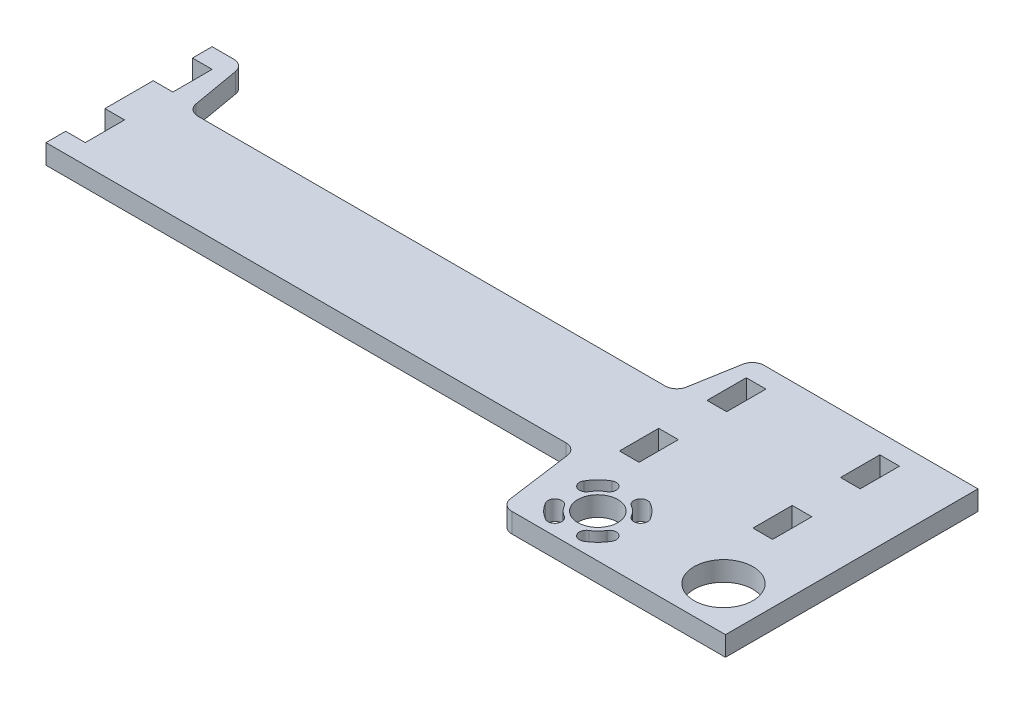
from build123d import *

# Parameters (mm, degrees)
SKETCH_1_R      = 5.1
SKETCH_1_R_2    = 7.5
SKETCH_1_W      = 5
SKETCH_1_H      = 10
EXTRUDE_1_DEPTH = 5


with BuildPart() as part:
    # 草图1 → 凸台-拉伸1 (new body)
    with BuildSketch(Plane(origin=(0, 0, 0), x_dir=(1, 0, 0), z_dir=(0, 1, 0))):
        with BuildLine():
            Line((41.226602941, -22.421259901), (43.51896829, -39.231939129))
            ThreePointArc((43.51896829, -39.231939129), (44.518645935, -41.086690093), (46.491458794, -41.826599515))
            Line((46.491458794, -41.826599515), (46.872785616, -41.826599515))
            Line((46.872785616, -41.826599515), (100.872785616, -41.826599515))
            Line((100.872785616, -41.826599515), (100.872785616, -21.15))
            Line((100.872785616, -21.15), (100.872785616, 22.473400485))
            Line((100.872785616, 22.473400485), (46.393557665, 22.473400485))
            ThreePointArc((46.393557665, 22.473400485), (44.463634871, 21.770223946), (43.438429698, 19.990332491))
            Line((43.438429698, 19.990332491), (41.307141533, 7.806468479))
            ThreePointArc((41.307141533, 7.806468479), (40.28193636, 6.026577025), (38.352013566, 5.323400485))
            Line((38.352013566, 5.323400485), (-80.606442335, 5.323400485))
            ThreePointArc((-80.606442335, 5.323400485), (-82.536365129, 6.026577025), (-83.561570302, 7.806468479))
            Line((-83.561570302, 7.806468479), (-85.692858467, 19.990332491))
            ThreePointArc((-85.692858467, 19.990332491), (-86.71806364, 21.770223946), (-88.647986434, 22.473400485))
            Line((-88.647986434, 22.473400485), (-94.127214384, 22.473400485))
            Line((-94.127214384, 22.473400485), (-94.127214384, 17.473400485))
            Line((-94.127214384, 17.473400485), (-89.127214384, 17.473400485))
            Line((-89.127214384, 17.473400485), (-89.127214384, 7.473400485))
            Line((-89.127214384, 7.473400485), (-94.127214384, 7.473400485))
            Line((-94.127214384, 7.473400485), (-94.127214384, -4.826599515))
            Line((-94.127214384, -4.826599515), (-89.127214384, -4.826599515))
            Line((-89.127214384, -4.826599515), (-89.127214384, -14.826599515))
            Line((-89.127214384, -14.826599515), (-94.127214384, -14.826599515))
            Line((-94.127214384, -14.826599515), (-94.127214384, -19.826599515))
            Line((-94.127214384, -19.826599515), (38.254112437, -19.826599515))
            ThreePointArc((38.254112437, -19.826599515), (40.226925296, -20.566508937), (41.226602941, -22.421259901))
        make_face()
        with Locations(Location((57.372785616, -30.826599515, 0), (0, 0, 270))):
            Circle(SKETCH_1_R, mode=Mode.SUBTRACT)
        with Locations(Location((89.372785616, -30.826599515, 0), (0, 0, 270))):
            Circle(SKETCH_1_R_2, mode=Mode.SUBTRACT)
        with Locations((49.372785616, 12.473400485)):
            Rectangle(SKETCH_1_W, SKETCH_1_H, mode=Mode.SUBTRACT)
        with Locations((49.372785616, -9.826599515)):
            Rectangle(SKETCH_1_W, SKETCH_1_H, mode=Mode.SUBTRACT)
        with Locations((83.372785616, -9.826599515)):
            Rectangle(SKETCH_1_W, SKETCH_1_H, mode=Mode.SUBTRACT)
        with Locations((83.372785616, 12.473400485)):
            Rectangle(SKETCH_1_W, SKETCH_1_H, mode=Mode.SUBTRACT)
        with BuildLine():
            ThreePointArc((52.497785616, -22.382851828), (50.478494499, -23.932308398), (48.929037929, -25.951599515))
            ThreePointArc((48.929037929, -25.951599515), (49.569582385, -28.342143972), (51.960126842, -27.701599515))
            ThreePointArc((51.960126842, -27.701599515), (52.953368233, -26.407182132), (54.247785616, -25.413940741))
            ThreePointArc((54.247785616, -25.413940741), (54.888330072, -23.023396285), (52.497785616, -22.382851828))
        make_face(mode=Mode.SUBTRACT)
        with BuildLine():
            ThreePointArc((65.816533303, -25.951599503), (64.267076731, -23.932308389), (62.247785614, -22.38285182))
            ThreePointArc((62.247785614, -22.38285182), (59.857241158, -23.023396278), (60.497785616, -25.413940734))
            ThreePointArc((60.497785616, -25.413940734), (61.792202999, -26.407182125), (62.785444391, -27.701599506))
            ThreePointArc((62.785444391, -27.701599506), (65.175988849, -28.34214396), (65.816533303, -25.951599503))
        make_face(mode=Mode.SUBTRACT)
        with BuildLine():
            ThreePointArc((62.247785626, -39.270347195), (64.267076742, -37.720890621), (65.81653331, -35.701599501))
            ThreePointArc((65.81653331, -35.701599501), (65.175988849, -33.311055045), (62.785444394, -33.951599506))
            ThreePointArc((62.785444394, -33.951599506), (61.792203004, -35.24601689), (60.497785622, -36.239258284))
            ThreePointArc((60.497785622, -36.239258284), (59.857241169, -38.629802741), (62.247785626, -39.270347195))
        make_face(mode=Mode.SUBTRACT)
        with BuildLine():
            ThreePointArc((48.929037937, -35.701599515), (50.478494509, -37.720890632), (52.497785627, -39.270347201))
            ThreePointArc((52.497785627, -39.270347201), (54.888330083, -38.629802742), (54.247785624, -36.239258286))
            ThreePointArc((54.247785624, -36.239258286), (52.953368241, -35.246016896), (51.960126849, -33.951599514))
            ThreePointArc((51.960126849, -33.951599514), (49.569582392, -33.311055058), (48.929037937, -35.701599515))
        make_face(mode=Mode.SUBTRACT)
    extrude(amount=EXTRUDE_1_DEPTH)


solid = part.part
